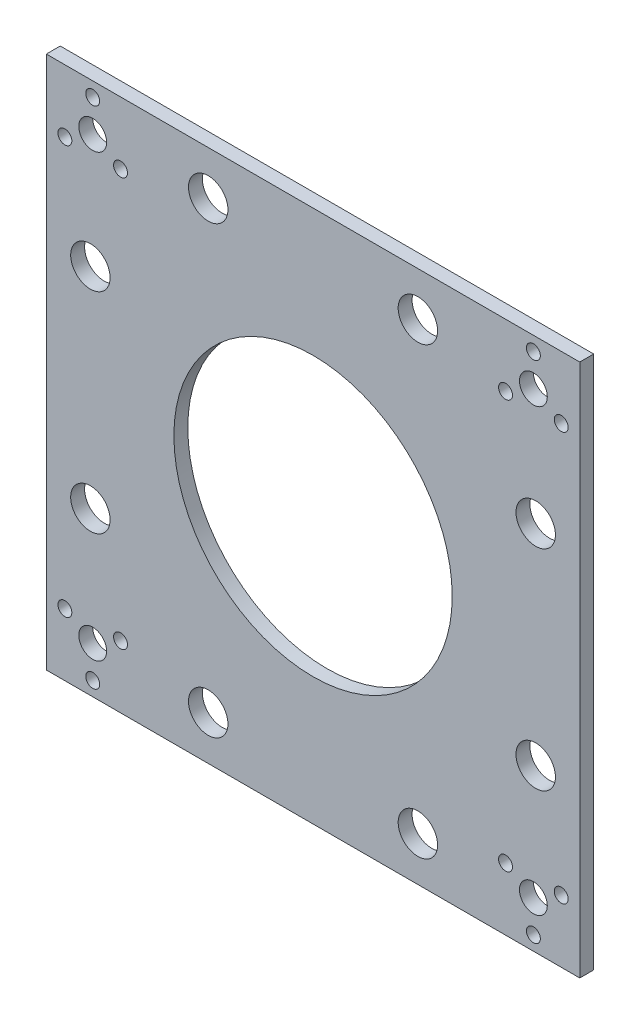
from build123d import *

# Parameters (mm, degrees)
SKETCH_1_W            = 115
SKETCH_1_H            = 115
SKETCH_1_R            = 30
SKETCH_1_R_2          = 3
EXTRUDE_1_DEPTH       = 3
CUT_EXTRUDE_2_DEPTH   = 82.372599811
MIRROR_4_COPY_1_DEPTH = 82.372599811
SKETCH_4_R            = 4.25
CUT_EXTRUDE_3_DEPTH   = 3


with BuildPart() as part:
    # 草图1 → 凸台-拉伸1 (new body)
    with BuildSketch(Plane.XY):
        Rectangle(SKETCH_1_W, SKETCH_1_H)
        Circle(SKETCH_1_R, mode=Mode.SUBTRACT)
        with Locations((-47.5, 47.5)):
            Circle(SKETCH_1_R_2, mode=Mode.SUBTRACT)
        with Locations((47.5, 47.5)):
            Circle(SKETCH_1_R_2, mode=Mode.SUBTRACT)
        with Locations((47.5, -47.5)):
            Circle(SKETCH_1_R_2, mode=Mode.SUBTRACT)
        with Locations((-47.5, -47.5)):
            Circle(SKETCH_1_R_2, mode=Mode.SUBTRACT)
    extrude(amount=EXTRUDE_1_DEPTH)

    # 草图3 → 切除-拉伸2 (cut, through all)
    with BuildSketch(Plane.XY.offset(3)):
        with BuildLine():
            ThreePointArc((-52, 44.035898385), (-52.200961894, 44.785898385), (-52.75, 45.334936491))
            Line((-52.75, 45.334936491), (-53.5, 44.035898385))
            Line((-53.5, 44.035898385), (-52, 44.035898385))
        make_face()
        with BuildLine():
            Line((-53.5, 44.035898385), (-52.75, 45.334936491))
            ThreePointArc((-52.75, 45.334936491), (-54.799038106, 43.285898385), (-52, 44.035898385))
            Line((-52, 44.035898385), (-53.5, 44.035898385))
        make_face()
        with BuildLine():
            ThreePointArc((-40, 44.035898385), (-40.75, 45.334936491), (-42.25, 45.334936491))
            Line((-42.25, 45.334936491), (-41.5, 44.035898385))
            Line((-41.5, 44.035898385), (-43, 44.035898385))
            ThreePointArc((-43, 44.035898385), (-41.5, 42.535898385), (-40, 44.035898385))
        make_face()
        with BuildLine():
            Line((-41.5, 44.035898385), (-42.25, 45.334936491))
            ThreePointArc((-42.25, 45.334936491), (-42.799038106, 44.785898385), (-43, 44.035898385))
            Line((-43, 44.035898385), (-41.5, 44.035898385))
        make_face()
        with BuildLine():
            Line((-46.75, 53.129165125), (-47.5, 54.42820323))
            Line((-47.5, 54.42820323), (-48.25, 53.129165125))
            ThreePointArc((-48.25, 53.129165125), (-47.5, 52.92820323), (-46.75, 53.129165125))
        make_face()
        with BuildLine():
            Line((-48.25, 53.129165125), (-47.5, 54.42820323))
            Line((-47.5, 54.42820323), (-46.75, 53.129165125))
            ThreePointArc((-46.75, 53.129165125), (-46.200961894, 53.67820323), (-46, 54.42820323))
            ThreePointArc((-46, 54.42820323), (-48.25, 55.727241336), (-48.25, 53.129165125))
        make_face()
    cut_extrude_2 = extrude(amount=-CUT_EXTRUDE_2_DEPTH, mode=Mode.SUBTRACT)

    # 镜向3: 切除-拉伸2 across plane
    add(cut_extrude_2.mirror(Plane(origin=(0, 0, 0), x_dir=(0, 0, 1), z_dir=(1, 0, 0))), mode=Mode.SUBTRACT)

    # 镜向4: 切除-拉伸2 across plane
    add(cut_extrude_2.mirror(Plane.ZX), mode=Mode.SUBTRACT)

    # 镜向4 copy 1 sketch → 镜向4 copy 1 (cut, through all)
    with BuildSketch(Plane(origin=(0, 0, 3), x_dir=(-1, 0, 0), z_dir=(0, 0, 1))):
        with BuildLine():
            ThreePointArc((-52, 44.035898385), (-52.200961894, 44.785898385), (-52.75, 45.334936491))
            Line((-52.75, 45.334936491), (-53.5, 44.035898385))
            Line((-53.5, 44.035898385), (-52, 44.035898385))
        make_face()
        with BuildLine():
            Line((-53.5, 44.035898385), (-52.75, 45.334936491))
            ThreePointArc((-52.75, 45.334936491), (-54.799038106, 43.285898385), (-52, 44.035898385))
            Line((-52, 44.035898385), (-53.5, 44.035898385))
        make_face()
        with BuildLine():
            ThreePointArc((-40, 44.035898385), (-40.75, 45.334936491), (-42.25, 45.334936491))
            Line((-42.25, 45.334936491), (-41.5, 44.035898385))
            Line((-41.5, 44.035898385), (-43, 44.035898385))
            ThreePointArc((-43, 44.035898385), (-41.5, 42.535898385), (-40, 44.035898385))
        make_face()
        with BuildLine():
            Line((-41.5, 44.035898385), (-42.25, 45.334936491))
            ThreePointArc((-42.25, 45.334936491), (-42.799038106, 44.785898385), (-43, 44.035898385))
            Line((-43, 44.035898385), (-41.5, 44.035898385))
        make_face()
        with BuildLine():
            Line((-46.75, 53.129165125), (-47.5, 54.42820323))
            Line((-47.5, 54.42820323), (-48.25, 53.129165125))
            ThreePointArc((-48.25, 53.129165125), (-47.5, 52.92820323), (-46.75, 53.129165125))
        make_face()
        with BuildLine():
            Line((-48.25, 53.129165125), (-47.5, 54.42820323))
            Line((-47.5, 54.42820323), (-46.75, 53.129165125))
            ThreePointArc((-46.75, 53.129165125), (-46.200961894, 53.67820323), (-46, 54.42820323))
            ThreePointArc((-46, 54.42820323), (-48.25, 55.727241336), (-48.25, 53.129165125))
        make_face()
    extrude(amount=-MIRROR_4_COPY_1_DEPTH, mode=Mode.SUBTRACT)

    # 草图4 → 切除-拉伸3 (cut)
    with BuildSketch(Plane.XY.offset(3)):
        with Locations((-22.6, 48)):
            Circle(SKETCH_4_R)
        with Locations((-48, 22.6)):
            Circle(SKETCH_4_R)
        with Locations((22.6, 48)):
            Circle(SKETCH_4_R)
        with Locations((48, 22.6)):
            Circle(SKETCH_4_R)
        with Locations((48, -22.6)):
            Circle(SKETCH_4_R)
        with Locations((22.6, -48)):
            Circle(SKETCH_4_R)
        with Locations((-48, -22.6)):
            Circle(SKETCH_4_R)
        with Locations((-22.6, -48)):
            Circle(SKETCH_4_R)
    extrude(amount=-CUT_EXTRUDE_3_DEPTH, mode=Mode.SUBTRACT)


solid = part.part
